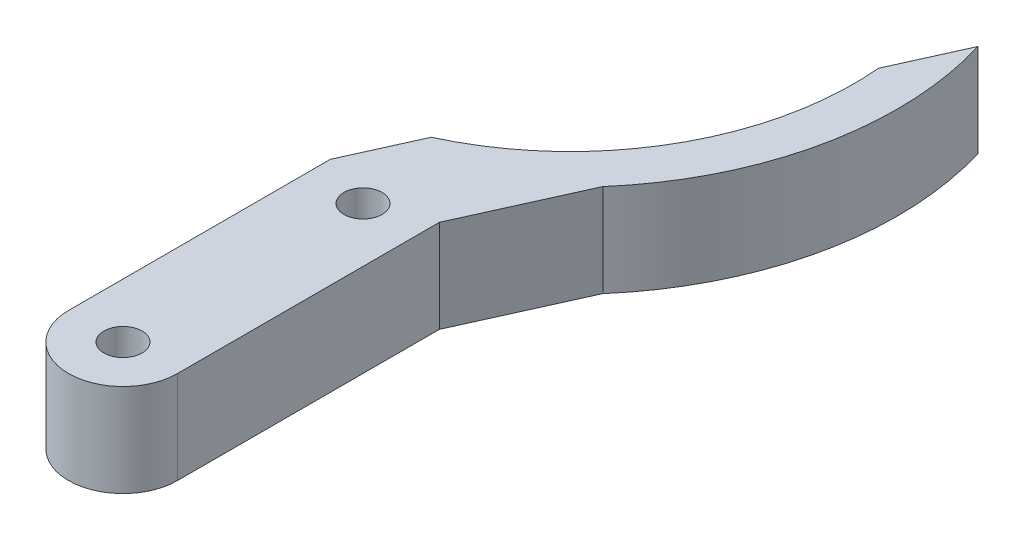
from build123d import *

# Parameters (mm, degrees)
SKETCH_1_R      = 1.75
EXTRUDE_1_DEPTH = 8.5


with BuildPart() as part:
    # 草图1 → 凸台-拉伸1 (new body)
    with BuildSketch(Plane(origin=(0, 0, 0), x_dir=(1, 0, 0), z_dir=(0, 1, 0))):
        with BuildLine():
            Line((-5, 0), (-5, 24))
            Line((-5, 24), (-2.126373263, 30.38296713))
            ThreePointArc((-2.126373263, 30.38296713), (9.506773104, 40.982889551), (12.893369562, 56.352320712))
            Line((12.893369562, 56.352320712), (15.726983551, 62.646410588))
            ThreePointArc((15.726983551, 62.646410588), (16.332137294, 47.705103516), (9.649595461, 34.32779053))
            Line((9.649595461, 34.32779053), (5, 24))
            Line((5, 24), (5, 0))
            ThreePointArc((5, 0), (0, -5), (-5, 0))
        make_face()
        with Locations(Location((0, 0, 0), (0, 0, 270))):
            Circle(SKETCH_1_R, mode=Mode.SUBTRACT)
        with Locations(Location((0, 22, 0), (0, 0, 270))):
            Circle(SKETCH_1_R, mode=Mode.SUBTRACT)
    extrude(amount=EXTRUDE_1_DEPTH)


solid = part.part
